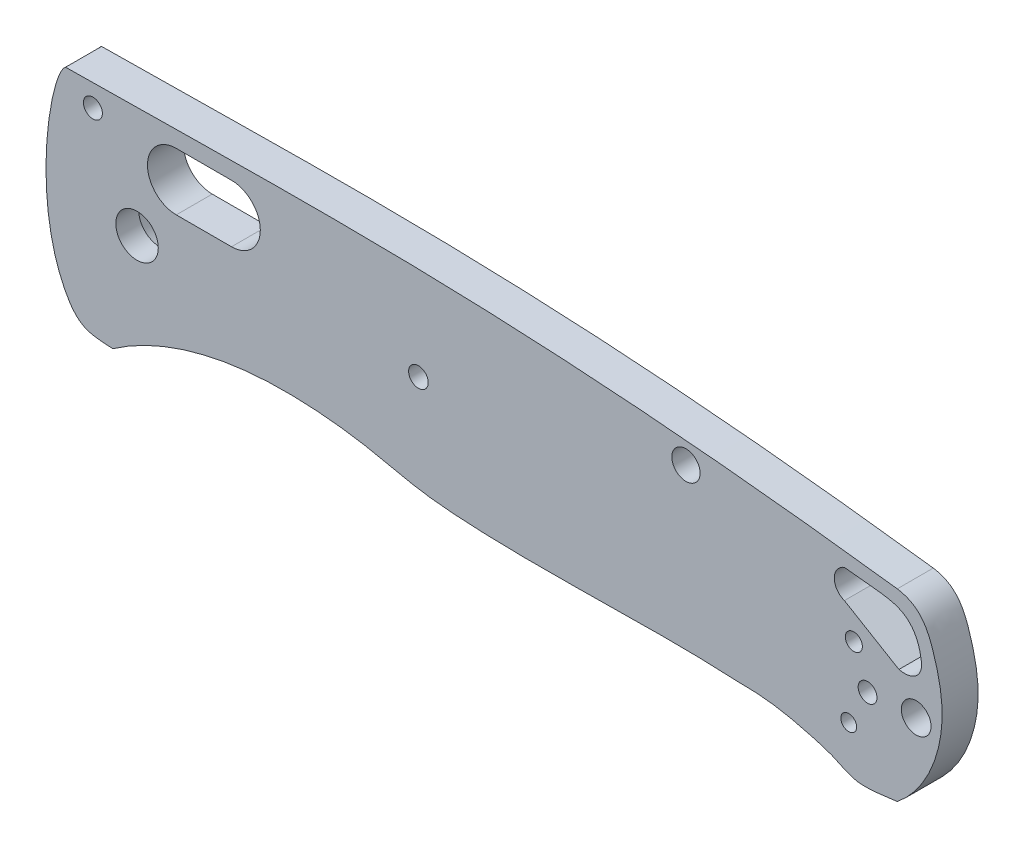
from build123d import *
from OCP.BRepFilletAPI import BRepFilletAPI_MakeChamfer

# Parameters (mm, degrees)
SKETCH1_R           = 1.10368272
SKETCH1_R_2         = 2.473771615
SKETCH1_R_3         = 1.141530029
SKETCH1_R_4         = 1.646532991
SKETCH1_R_5         = 0.992957035
SKETCH1_R_6         = 1.097250686
SKETCH1_R_7         = 0.919737921
SKETCH1_R_8         = 1.733023824
BOSS_EXTRUDE1_DEPTH = 4.191
CHAMFER1_SIZE       = 1.524
CHAMFER1_SIZE2      = 0.408354569


with BuildPart() as part:
    # Sketch1 → Boss-Extrude1 (new body)
    with BuildSketch(Plane.XY):
        with BuildLine():
            add(Edge.make_bspline(
                [(15.512876253, 63.725280297), (42.719401206, 63.948789993), (66.786450327, 65.385157199), (112.372925873, 59.54513019)],
                knots=[0, 0, 0, 0, 1, 1, 1, 1], degree=3))
            add(Edge.make_bspline(
                [(112.372925873, 59.54513019), (115.06163518, 59.135245646), (116.794510744, 55.30628864), (118.469687047, 47.231155573), (115.676928934, 40.73972784), (112.372925873, 38.089347261)],
                knots=[0, 0, 0, 0, 0.242320807, 0.484361008, 1, 1, 1, 1], degree=3))
            add(Edge.make_bspline(
                [(112.372925873, 38.089347261), (110.885555874, 37.883707638), (108.600235295, 37.607741566), (106.511043014, 38.028810817), (105.081904878, 38.917056614), (100.621256306, 40.212100692), (97.582606658, 40.947501698), (93.728353676, 40.905124022)],
                knots=[0, 0, 0, 0, 0.125673067, 0.162909154, 0.349088462, 0.435124788, 1, 1, 1, 1], degree=3))
            add(Edge.make_bspline(
                [(93.728353676, 40.905124022), (83.438696491, 41.478986396), (70.837114823, 40.450114199), (56.41922121, 41.6044677), (50.671354177, 43.09350077), (43.718819381, 43.91198411), (33.442775683, 43.82543302), (25.433984632, 41.165000317), (21.011717493, 38.089347261)],
                knots=[0, 0, 0, 0, 0.42688035, 0.50037363, 0.585645125, 0.666780076, 0.783694685, 1, 1, 1, 1], degree=3))
            add(Edge.make_bspline(
                [(21.011717493, 38.089347261), (19.810582443, 38.150303915), (17.367560982, 38.137908515), (11.153943442, 47.277156737), (13.736966959, 62.504701038), (15.512876253, 63.725280297)],
                knots=[0, 0, 0, 0, 0.130512904, 0.225933871, 1, 1, 1, 1], degree=3))
        make_face()
        with Locations((18.694741626, 61.201988498)):
            Circle(SKETCH1_R, mode=Mode.SUBTRACT)
        with Locations((23.83257498, 50.888263766)):
            Circle(SKETCH1_R_2, mode=Mode.SUBTRACT)
        with Locations((56.603802785, 53.028132556)):
            Circle(SKETCH1_R_3, mode=Mode.SUBTRACT)
        with Locations((87.762338524, 59.723272367)):
            Circle(SKETCH1_R_4, mode=Mode.SUBTRACT)
        with Locations((107.309974975, 51.686722441)):
            Circle(SKETCH1_R_5, mode=Mode.SUBTRACT)
        with Locations((108.911518579, 47.378570146)):
            Circle(SKETCH1_R_6, mode=Mode.SUBTRACT)
        with Locations((106.717403841, 43.23057221)):
            Circle(SKETCH1_R_7, mode=Mode.SUBTRACT)
        with Locations((114.575325698, 47.631735726)):
            Circle(SKETCH1_R_8, mode=Mode.SUBTRACT)
        with BuildLine():
            Line((28.403240505, 61.983635523), (34.837697919, 61.983635523))
            ThreePointArc((34.837697919, 61.983635523), (38.190335559, 58.630997882), (34.837697919, 55.278360242))
            Line((34.837697919, 55.278360242), (28.403240505, 55.278360242))
            ThreePointArc((28.403240505, 55.278360242), (25.050602865, 58.630997882), (28.403240505, 61.983635523))
        make_face(mode=Mode.SUBTRACT)
        with BuildLine():
            Line((106.21301999, 55.283465905), (112.563548609, 51.509323308))
            add(Edge.make_bspline(
                [(106.21301999, 58.630997882), (109.208741336, 58.225755094), (113.240394983, 58.369560335), (114.982397754, 55.424174213), (115.335874029, 52.312472158), (114.137714748, 51.176326624), (112.563548609, 51.509323308)],
                knots=[0, 0, 0, 0, 0.426431776, 0.761667371, 0.819024193, 1, 1, 1, 1], degree=3))
            ThreePointArc((106.21301999, 58.630997882), (105.039294672, 56.957231894), (106.21301999, 55.283465905))
        make_face(mode=Mode.SUBTRACT)
    extrude(amount=BOSS_EXTRUDE1_DEPTH)

    # Chamfer1: one chamfer whose edges measure the first distance from different faces: ONE call of the kernel's chamfer builder (chamfer() names one face for all edges)
    chamfer1_edges_1 = [part.edges().sort_by_distance(p)[0] for p in [
        (21.358803365, 50.888263766, 0),
    ]]
    chamfer1_side_1 = [part.faces().sort_by_distance(p)[0] for p in [
        (21.358803365, 50.888263766, 2.0955),
    ]]
    chamfer1_edges_2 = [part.edges().sort_by_distance(p)[0] for p in [
        (55.462272756, 53.028132556, 0),
    ]]
    chamfer1_side_2 = [part.faces().sort_by_distance(p)[0] for p in [
        (55.462272756, 53.028132556, 2.0955),
    ]]
    chamfer1_edges_3 = [part.edges().sort_by_distance(p)[0] for p in [
        (86.115805532, 59.723272367, 0),
    ]]
    chamfer1_side_3 = [part.faces().sort_by_distance(p)[0] for p in [
        (86.115805532, 59.723272367, 2.0955),
    ]]
    chamfer1_edges_4 = [part.edges().sort_by_distance(p)[0] for p in [
        (106.31701794, 51.686722441, 0),
    ]]
    chamfer1_side_4 = [part.faces().sort_by_distance(p)[0] for p in [
        (106.31701794, 51.686722441, 2.0955),
    ]]
    chamfer1_edges_5 = [part.edges().sort_by_distance(p)[0] for p in [
        (107.814267893, 47.378570146, 0),
    ]]
    chamfer1_side_5 = [part.faces().sort_by_distance(p)[0] for p in [
        (107.814267893, 47.378570146, 2.0955),
    ]]
    chamfer1_edges_6 = [part.edges().sort_by_distance(p)[0] for p in [
        (105.79766592, 43.23057221, 0),
    ]]
    chamfer1_side_6 = [part.faces().sort_by_distance(p)[0] for p in [
        (105.79766592, 43.23057221, 2.0955),
    ]]
    chamfer1_edges_7 = [part.edges().sort_by_distance(p)[0] for p in [
        (112.842301875, 47.631735726, 0),
    ]]
    chamfer1_side_7 = [part.faces().sort_by_distance(p)[0] for p in [
        (112.842301875, 47.631735726, 2.0955),
    ]]
    chamfer1 = BRepFilletAPI_MakeChamfer(part.part.solid().wrapped)
    for e in chamfer1_edges_1:
        chamfer1.Add(CHAMFER1_SIZE, CHAMFER1_SIZE2, e.wrapped, chamfer1_side_1[0].wrapped)  # the first distance lies on this face
    for e in chamfer1_edges_2:
        chamfer1.Add(CHAMFER1_SIZE, CHAMFER1_SIZE2, e.wrapped, chamfer1_side_2[0].wrapped)  # the first distance lies on this face
    for e in chamfer1_edges_3:
        chamfer1.Add(CHAMFER1_SIZE, CHAMFER1_SIZE2, e.wrapped, chamfer1_side_3[0].wrapped)  # the first distance lies on this face
    for e in chamfer1_edges_4:
        chamfer1.Add(CHAMFER1_SIZE, CHAMFER1_SIZE2, e.wrapped, chamfer1_side_4[0].wrapped)  # the first distance lies on this face
    for e in chamfer1_edges_5:
        chamfer1.Add(CHAMFER1_SIZE, CHAMFER1_SIZE2, e.wrapped, chamfer1_side_5[0].wrapped)  # the first distance lies on this face
    for e in chamfer1_edges_6:
        chamfer1.Add(CHAMFER1_SIZE, CHAMFER1_SIZE2, e.wrapped, chamfer1_side_6[0].wrapped)  # the first distance lies on this face
    for e in chamfer1_edges_7:
        chamfer1.Add(CHAMFER1_SIZE, CHAMFER1_SIZE2, e.wrapped, chamfer1_side_7[0].wrapped)  # the first distance lies on this face
    add(Compound.cast(chamfer1.Shape()), mode=Mode.REPLACE)


solid = part.part
